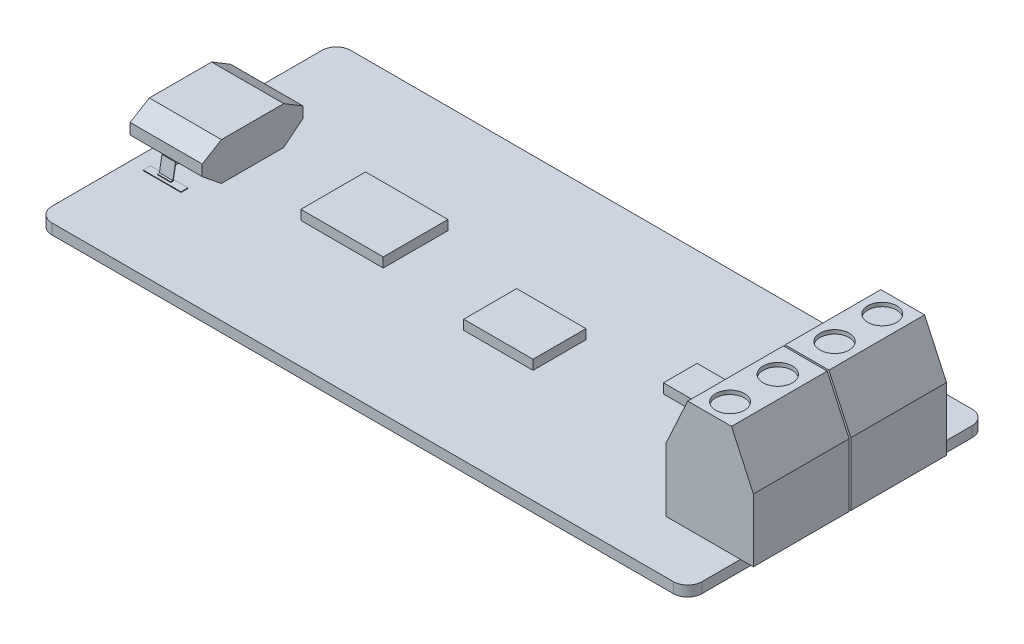
from build123d import *

# Parameters (mm, degrees)
BOSS_EXTRUDE1_DEPTH      = 0.405
FILLET1_R                = 1.12
CHAMFER1_SIZE            = 0.5
SKETCH2_R                = 1.1
CUT_EXTRUDE1_DEPTH       = 16.574075414
BOSS_EXTRUDE2_DEPTH      = 0.5
BOSS_EXTRUDE2_DEPTH_BACK = 5.1
SKETCH4_W                = 2.941717286
SKETCH4_H                = 0.549853698
BOSS_EXTRUDE3_DEPTH      = 0.05
BOSS_EXTRUDE4_DEPTH      = 0.525
SKETCH6_R                = 0.577649515
CUT_EXTRUDE2_DEPTH       = 17.26947218
SKETCH7_W                = 50.5
SKETCH7_H                = 23.21
BOSS_EXTRUDE5_DEPTH      = 0.81
FILLET2_R                = 1.12
SKETCH8_W                = 6.401014247
SKETCH8_H                = 5.029368337
SKETCH8_W_2              = 5.38498024
SKETCH8_H_2              = 4.114937731
SKETCH8_W_3              = 3.96253263
SKETCH8_H_3              = 2.617558371
BOSS_EXTRUDE6_DEPTH      = 0.75
BOSS_EXTRUDE7_DEPTH      = 7.5
SKETCH10_W               = 0.132636096
SKETCH10_H               = 11.074362277
CUT_EXTRUDE3_DEPTH       = 6.8
SKETCH11_R               = 1.123282604
SKETCH11_R_2             = 1.136386451
CUT_EXTRUDE4_DEPTH       = 0.3


with BuildPart() as part:
    # Sketch1 → Boss-Extrude1 (new, symmetric)
    with BuildSketch(Plane(origin=(0, 0, 0), x_dir=(1, 0, 0), z_dir=(0, 1, 0))):
        Polygon((-13.55, 7.635), (11.83, 7.635), (11.83, 3.675), (13.55, 2.295), (13.55, -2.295), (11.83, -3.675), (11.83, -7.635), (-13.55, -7.635), align=None)
    extrude(amount=BOSS_EXTRUDE1_DEPTH, both=True)

    # Fillet1
    fillet1_edges = [part.edges().sort_by_distance(p)[0] for p in [
        (-13.55, 0, -7.635),
        (-13.55, 0, 7.635),
    ]]
    fillet(fillet1_edges, radius=FILLET1_R)

    # Chamfer1
    chamfer1_edges = [part.edges().sort_by_distance(p)[0] for p in [
        (11.83, 0, -7.635),
        (11.83, 0, 7.635),
    ]]
    chamfer(chamfer1_edges, length=CHAMFER1_SIZE)

    # Sketch2 → Cut-Extrude1 (cut, through all)
    with BuildSketch(Plane(origin=(0, 0.405, 0), x_dir=(1, 0, 0), z_dir=(0, 1, 0))):
        with Locations(Location((9.57, 5.74, 0), (0, 0, 270))):
            Circle(SKETCH2_R)
        with Locations(Location((9.57, -5.74, 0), (0, 0, 270))):
            Circle(SKETCH2_R)
    extrude(amount=-CUT_EXTRUDE1_DEPTH, mode=Mode.SUBTRACT)

    # Sketch4 → Boss-Extrude3 (add)
    with BuildSketch(Plane(origin=(0, 0.405, 0), x_dir=(1, 0, 0), z_dir=(0, 1, 0))):
        with Locations((-10.930908088, 4.275112504)):
            Rectangle(SKETCH4_W, SKETCH4_H)
        with Locations((-10.930908088, -4.275112504)):
            Rectangle(SKETCH4_W, SKETCH4_H)
    extrude(amount=BOSS_EXTRUDE3_DEPTH)



with BuildPart() as body_2:
    # Sketch3 → Boss-Extrude2 (new, two sides: drawn at the far end of the back side and taken through both)
    with BuildSketch(Plane.ZY.offset(13.55).offset(-BOSS_EXTRUDE2_DEPTH_BACK)):
        Polygon((-3.91, 1.655), (-2.42, 0.455), (2.42, 0.455), (3.91, 1.655), (3.91, 2.505), (2.42, 3.405), (-2.42, 3.405), (-3.91, 2.505), align=None)
    extrude(amount=BOSS_EXTRUDE2_DEPTH + BOSS_EXTRUDE2_DEPTH_BACK)


with BuildPart() as part_1:
    add(part.part)

    add(body_2.part)  # Boss-Extrude4 merges body 2
    # Sketch5 → Boss-Extrude4 (add, symmetric)
    with BuildSketch(Plane(origin=(-11, 0, 0), x_dir=(0, 0, -1), z_dir=(1, 0, 0))):
        Polygon((4.325381098, 0.455), (4.325381098, 0.509426612), (4.162105788, 0.509426612), (3.964358919, 1.644096311), (3.498388432, 1.644096311), (3.498388432, 1.44259556), (3.964358919, 1.44259556), (4.136474144, 0.455), align=None)
        Polygon((-4.136474144, 0.455), (-4.325381098, 0.455), (-4.325381098, 0.509426612), (-4.162105788, 0.509426612), (-3.964358919, 1.644096311), (-3.498388432, 1.644096311), (-3.498388432, 1.44259556), (-3.964358919, 1.44259556), align=None)
    extrude(amount=BOSS_EXTRUDE4_DEPTH, both=True)

    # Sketch6 → Cut-Extrude2 (cut, through all)
    with BuildSketch(Plane(origin=(0, 0.405, 0), x_dir=(1, 0, 0), z_dir=(0, 1, 0))):
        with Locations(Location((-5.985172419, 5.913658107, 0), (0, 0, 270))):
            Circle(SKETCH6_R)
        with Locations(Location((-3.485172419, 5.913658107, 0), (0, 0, 270))):
            Circle(SKETCH6_R)
        with Locations(Location((-0.985172419, 5.913658107, 0), (0, 0, 270))):
            Circle(SKETCH6_R)
        with Locations(Location((1.514827581, 5.913658107, 0), (0, 0, 270))):
            Circle(SKETCH6_R)
        with Locations(Location((4.014827581, 5.913658107, 0), (0, 0, 270))):
            Circle(SKETCH6_R)
        with Locations(Location((4.014827581, -5.913658107, 0), (0, 0, 90))):
            Circle(SKETCH6_R)
        with Locations(Location((1.514827581, -5.913658107, 0), (0, 0, 90))):
            Circle(SKETCH6_R)
        with Locations(Location((-0.985172419, -5.913658107, 0), (0, 0, 90))):
            Circle(SKETCH6_R)
        with Locations(Location((-3.485172419, -5.913658107, 0), (0, 0, 90))):
            Circle(SKETCH6_R)
        with Locations(Location((-5.985172419, -5.913658107, 0), (0, 0, 90))):
            Circle(SKETCH6_R)
    extrude(amount=-CUT_EXTRUDE2_DEPTH, mode=Mode.SUBTRACT)

    # Sketch7 → Boss-Extrude5 (add)
    with BuildSketch(Plane(origin=(0, 0.405, 0), x_dir=(1, 0, 0), z_dir=(0, 1, 0))):
        with Locations((11.7, 0)):
            Rectangle(SKETCH7_W, SKETCH7_H)
    extrude(amount=-BOSS_EXTRUDE5_DEPTH)

    # Fillet2
    fillet2_edges = [part_1.edges().sort_by_distance(p)[0] for p in [
        (-13.55, 0, 11.605),
        (-13.55, 0, -11.605),
        (36.95, 0, -11.605),
        (36.95, 0, 11.605),
    ]]
    fillet(fillet2_edges, radius=FILLET2_R)

    # Sketch8 → Boss-Extrude6 (add)
    with BuildSketch(Plane(origin=(0, 0.405, 0), x_dir=(1, 0, 0), z_dir=(0, 1, 0))):
        with Locations((0.273625917, 0.73916626)):
            Rectangle(SKETCH8_W, SKETCH8_H)
        with Locations((13.482068015, -0.784884752)):
            Rectangle(SKETCH8_W_2, SKETCH8_H_2)
        with Locations((24.8108472, 1.945071243)):
            Rectangle(SKETCH8_W_3, SKETCH8_H_3)
    extrude(amount=BOSS_EXTRUDE6_DEPTH)

    # Sketch9 → Boss-Extrude7 (add, symmetric)
    with BuildSketch(Plane.XY):
        Polygon((37.95, 0.405), (37.95, 5.305), (36.25, 9.005), (32.85, 9.005), (31.15, 5.305), (31.15, 0.405), align=None)
    extrude(amount=BOSS_EXTRUDE7_DEPTH, both=True)

    # Sketch10 → Cut-Extrude3 (cut)
    with BuildSketch(Plane(origin=(37.95, 0, 0), x_dir=(0, 0, -1), z_dir=(1, 0, 0))):
        with Locations((0, 5.942181138)):
            Rectangle(SKETCH10_W, SKETCH10_H)
    extrude(amount=-CUT_EXTRUDE3_DEPTH, mode=Mode.SUBTRACT)

    # Sketch11 → Cut-Extrude4 (cut)
    with BuildSketch(Plane(origin=(0, 9.005, 0), x_dir=(1, 0, 0), z_dir=(0, 1, 0))):
        with Locations(Location((34.55, 5.910055159, 0), (0, 0, 270))):
            Circle(SKETCH11_R)
        with Locations(Location((34.55, 2.205678961, 0), (0, 0, 270))):
            Circle(SKETCH11_R_2)
        with Locations(Location((34.55, -2.205678961, 0), (0, 0, 90))):
            Circle(SKETCH11_R_2)
        with Locations(Location((34.55, -5.910055159, 0), (0, 0, 90))):
            Circle(SKETCH11_R)
    extrude(amount=-CUT_EXTRUDE4_DEPTH, mode=Mode.SUBTRACT)


solid = part_1.part
